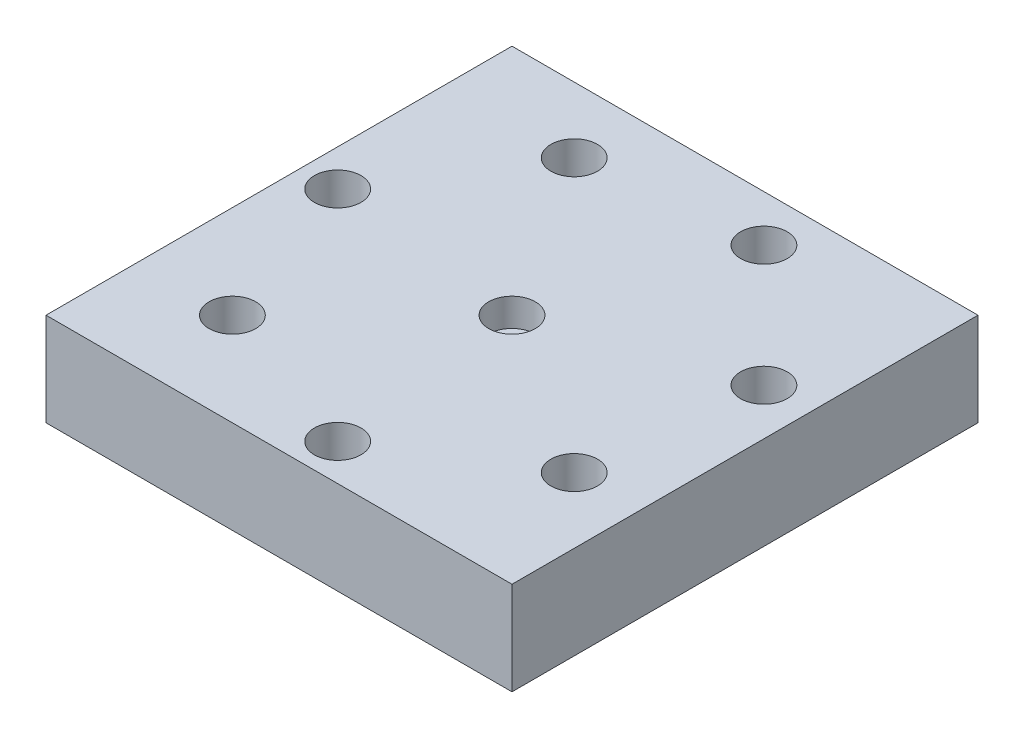
from build123d import *

# Parameters (mm, degrees)
SKETCH1_W                                           = 1270
SKETCH1_H                                           = 1270
SKETCH1_R                                           = 63.5
BOSS_EXTRUDE1_DEPTH                                 = 254
CBORE_FOR_00_BINDING_HEAD_MACHINE_SCREW_D           = 76.2
CBORE_FOR_00_BINDING_HEAD_MACHINE_SCREW_CBORE_D     = 127
CBORE_FOR_00_BINDING_HEAD_MACHINE_SCREW_CBORE_DEPTH = 76.2


with BuildPart() as part:
    # Sketch1 → Boss-Extrude1 (new body)
    with BuildSketch(Plane(origin=(0, 0, 0), x_dir=(1, 0, 0), z_dir=(0, 1, 0))):
        Rectangle(SKETCH1_W, SKETCH1_H)
        with Locations(Location((-381, -381, 0), (0, 0, 270))):
            Circle(SKETCH1_R, mode=Mode.SUBTRACT)
        with Locations(Location((-535.427409328, 60.328180312, 0), (0, 0, 270))):
            Circle(SKETCH1_R, mode=Mode.SUBTRACT)
        with Locations(Location((-286.667058704, 456.228010379, 0), (0, 0, 270))):
            Circle(SKETCH1_R, mode=Mode.SUBTRACT)
        with Locations(Location((177.959434067, 508.578843275, 0), (0, 0, 270))):
            Circle(SKETCH1_R, mode=Mode.SUBTRACT)
        with Locations(Location((508.578843275, 177.959434067, 0), (0, 0, 270))):
            Circle(SKETCH1_R, mode=Mode.SUBTRACT)
        with Locations(Location((456.228010379, -286.667058704, 0), (0, 0, 270))):
            Circle(SKETCH1_R, mode=Mode.SUBTRACT)
        with Locations(Location((60.328180312, -535.427409328, 0), (0, 0, 270))):
            Circle(SKETCH1_R, mode=Mode.SUBTRACT)
    extrude(amount=BOSS_EXTRUDE1_DEPTH)

    # CBORE for #00 Binding Head Machine Screw1 (through all)
    with Locations(Plane(origin=(0, 254, 0), x_dir=(1, 0, 0), z_dir=(0, 1, 0))):
        with Locations((0, 0)):
            CounterBoreHole(CBORE_FOR_00_BINDING_HEAD_MACHINE_SCREW_D / 2, CBORE_FOR_00_BINDING_HEAD_MACHINE_SCREW_CBORE_D / 2, CBORE_FOR_00_BINDING_HEAD_MACHINE_SCREW_CBORE_DEPTH)


solid = part.part
